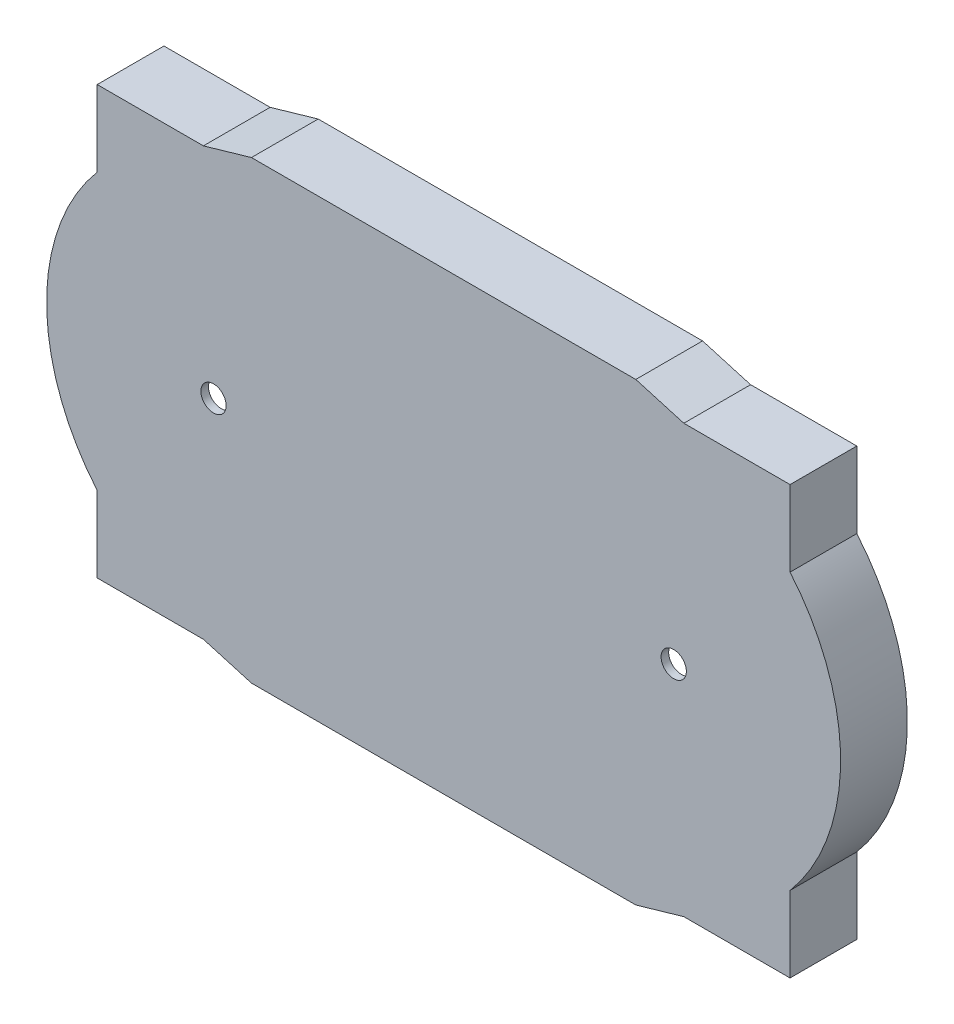
from build123d import *

# Parameters (mm, degrees)
SKETCH_1_W          = 157
SKETCH_1_H          = 90
EXTRUDE_1_DEPTH     = 13.2
CUT_EXTRUDE_1_DEPTH = 92.441183282
CUT_EXTRUDE_2_DEPTH = 92.441183282
SHELL_1_T           = -1.5
SKETCH_4_R          = 2.5
CUT_EXTRUDE_3_DEPTH = 13.2


with BuildPart() as part:
    # 草图1 → 凸台-拉伸1 (new body)
    with BuildSketch(Plane.XY):
        Rectangle(SKETCH_1_W, SKETCH_1_H)
    extrude(amount=EXTRUDE_1_DEPTH)

    # 草图2 → 切除-拉伸1 (cut, through all)
    with BuildSketch(Plane.XY.offset(13.2)):
        Polygon((-38, 45), (-47.5, 42.25), (-78.5, 42.25), (-78.5, 45), align=None)
        Polygon((78.5, 45), (38, 45), (47.5, 42.25), (78.5, 42.25), align=None)
        Polygon((38, -45), (47.5, -42.25), (78.5, -42.25), (78.5, -45), align=None)
        Polygon((-78.5, -45), (-38, -45), (-47.5, -42.25), (-78.5, -42.25), align=None)
    extrude(amount=-CUT_EXTRUDE_1_DEPTH, mode=Mode.SUBTRACT)

    # 草图3 → 切除-拉伸2 (cut, through all)
    with BuildSketch(Plane.XY.offset(13.2)):
        with BuildLine():
            Line((-68.5, 42.25), (-68.5, 27.25))
            ThreePointArc((-68.5, 27.25), (-78.499, 0), (-68.5, -27.25))
            Line((-68.5, -27.25), (-68.5, -42.25))
            Line((-68.5, -42.25), (-78.5, -42.25))
            Line((-78.5, -42.25), (-78.5, 42.25))
            Line((-78.5, 42.25), (-68.5, 42.25))
        make_face()
        with BuildLine():
            Line((68.5, -42.25), (68.5, -27.25))
            ThreePointArc((68.5, -27.25), (78.499, 0), (68.5, 27.25))
            Line((68.5, 27.25), (68.5, 42.25))
            Line((68.5, 42.25), (78.5, 42.25))
            Line((78.5, 42.25), (78.5, -42.25))
            Line((78.5, -42.25), (68.5, -42.25))
        make_face()
    extrude(amount=-CUT_EXTRUDE_2_DEPTH, mode=Mode.SUBTRACT)

    # 抽壳1
    shell_1_openings = [part.faces().sort_by_distance(p)[0] for p in [
        (0, 0, 0),
    ]]
    offset(amount=SHELL_1_T, openings=shell_1_openings, kind=Kind.INTERSECTION)

    # 草图4 → 切除-拉伸3 (cut)
    with BuildSketch(Plane(origin=(0, 0, 0), x_dir=(-1, 0, 0), z_dir=(0, 0, -1))):
        with Locations((-45.5, 0)):
            Circle(SKETCH_4_R)
        with Locations(Location((45.5, 0, 0), (0, 0, 180))):
            Circle(SKETCH_4_R)
    extrude(amount=-CUT_EXTRUDE_3_DEPTH, mode=Mode.SUBTRACT)


solid = part.part
